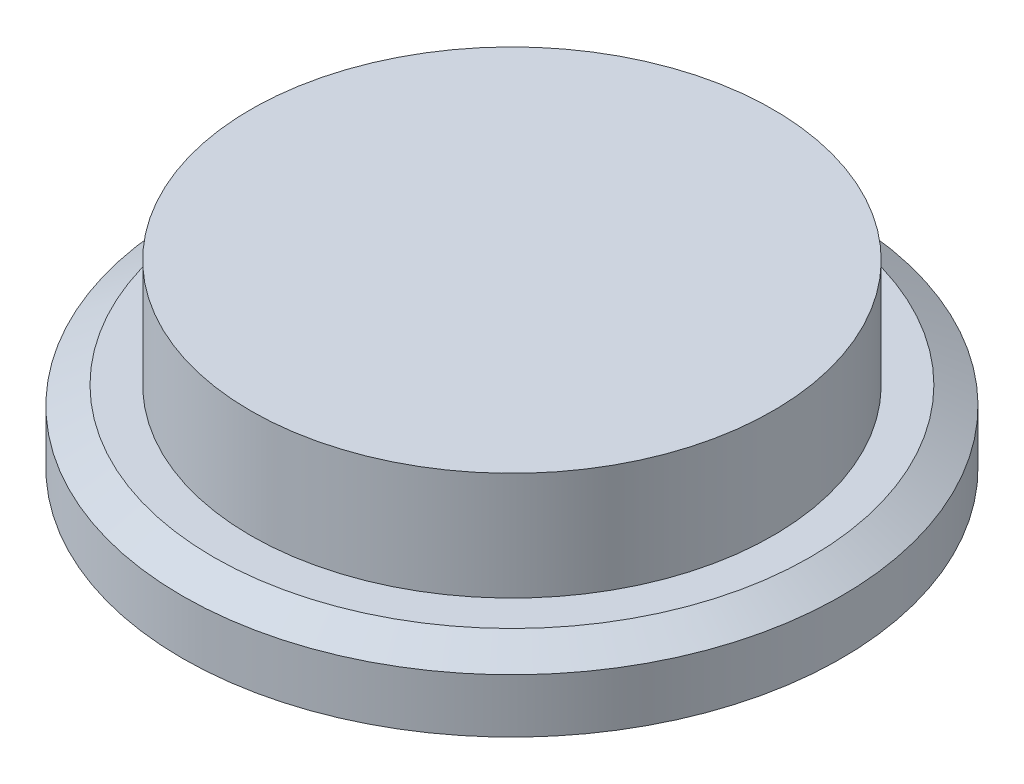
from build123d import *

# Parameters (mm, degrees)
SKETCH5_R           = 6
BOSS_EXTRUDE3_DEPTH = 1
SKETCH6_R           = 9.15
BOSS_EXTRUDE4_DEPTH = 2
CHAMFER1_SIZE       = 0.5
CHAMFER1_SIZE2      = 0.866025404
SKETCH7_R           = 7.25
BOSS_EXTRUDE5_DEPTH = 3


with BuildPart() as part:
    # Sketch5 → Boss-Extrude3 (new body)
    with BuildSketch(Plane(origin=(0, 0, 0), x_dir=(1, 0, 0), z_dir=(0, 1, 0))):
        with Locations(Location((0, 0, 0), (0, 0, 270))):
            Circle(SKETCH5_R)
    extrude(amount=BOSS_EXTRUDE3_DEPTH)

    # Sketch6 → Boss-Extrude4 (add)
    with BuildSketch(Plane(origin=(0, 1, 0), x_dir=(1, 0, 0), z_dir=(0, 1, 0))):
        with Locations(Location((0, 0, 0), (0, 0, 270))):
            Circle(SKETCH6_R)
    extrude(amount=BOSS_EXTRUDE4_DEPTH)

    # Chamfer1
    chamfer1_edges = [part.edges().sort_by_distance(p)[0] for p in [
        (0, 3, -9.15),
    ]]
    chamfer1_side = [part.faces().sort_by_distance(p)[0] for p in [
        (0, 2, -9.15),
    ]]
    chamfer(chamfer1_edges, length=CHAMFER1_SIZE, length2=CHAMFER1_SIZE2, reference=chamfer1_side[0])

    # Sketch7 → Boss-Extrude5 (add)
    with BuildSketch(Plane(origin=(0, 3, 0), x_dir=(1, 0, 0), z_dir=(0, 1, 0))):
        with Locations(Location((0, 0, 0), (0, 0, 270))):
            Circle(SKETCH7_R)
    extrude(amount=BOSS_EXTRUDE5_DEPTH)


solid = part.part
